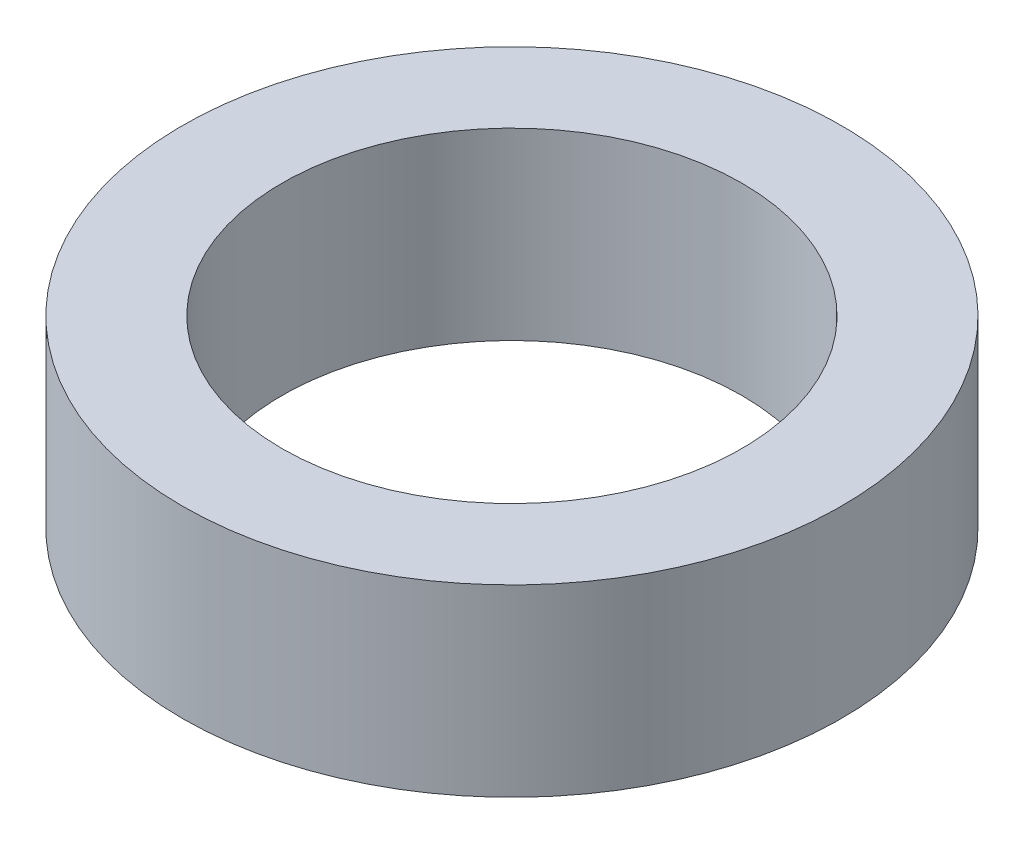
from build123d import *

# Parameters (mm, degrees)
SKETCH_1_R      = 21.5
SKETCH_1_R_2    = 15
EXTRUDE_1_DEPTH = 12


with BuildPart() as part:
    # 草图1 → 凸台-拉伸1 (new body)
    with BuildSketch(Plane(origin=(0, 0, 0), x_dir=(1, 0, 0), z_dir=(0, 1, 0))):
        with Locations(Location((0, 0, 0), (0, 0, 270))):
            Circle(SKETCH_1_R)
        with Locations(Location((0, 0, 0), (0, 0, 270))):
            Circle(SKETCH_1_R_2, mode=Mode.SUBTRACT)
    extrude(amount=EXTRUDE_1_DEPTH)


solid = part.part
